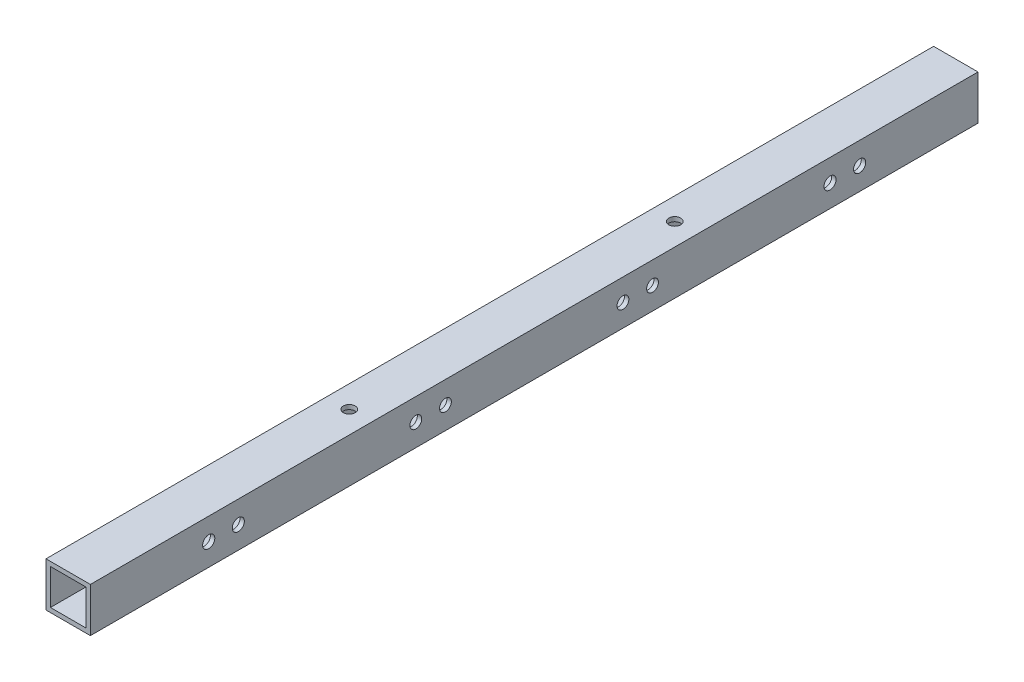
from build123d import *

# Parameters (mm, degrees)
SKETCH_1_W          = 15
SKETCH_1_H          = 15
SKETCH_1_W_2        = 12
SKETCH_1_H_2        = 12
EXTRUDE_1_DEPTH     = 300
SKETCH_2_R          = 2
CUT_EXTRUDE_1_DEPTH = 30
SKETCH_4_R          = 2.05
CUT_EXTRUDE_3_DEPTH = 120
SKETCH_5_R          = 2
CUT_EXTRUDE_4_DEPTH = 49


with BuildPart() as part:
    # 草图1 → 凸台-拉伸1 (new body)
    with BuildSketch(Plane.XY):
        Rectangle(SKETCH_1_W, SKETCH_1_H)
        Rectangle(SKETCH_1_W_2, SKETCH_1_H_2, mode=Mode.SUBTRACT)
    extrude(amount=EXTRUDE_1_DEPTH)

    # 草图2 → 切除-拉伸1 (cut)
    with BuildSketch(Plane(origin=(0, 7.5, 0), x_dir=(1, 0, 0), z_dir=(0, 1, 0))):
        with Locations(Location((0, -205, 0), (0, 0, 270))):
            Circle(SKETCH_2_R)
        with Locations(Location((0, -95, 0), (0, 0, 270))):
            Circle(SKETCH_2_R)
    extrude(amount=-CUT_EXTRUDE_1_DEPTH, mode=Mode.SUBTRACT)

    # 草图4 → 切除-拉伸3 (cut)
    with BuildSketch(Plane.ZY.offset(7.5)):
        with Locations((250, 0)):
            Circle(SKETCH_4_R)
        with Locations((260, 0)):
            Circle(SKETCH_4_R)
        with Locations(Location((40, 0, 0), (0, 0, 180))):
            Circle(SKETCH_4_R)
        with Locations(Location((50, 0, 0), (0, 0, 180))):
            Circle(SKETCH_4_R)
    extrude(amount=-CUT_EXTRUDE_3_DEPTH, mode=Mode.SUBTRACT)

    # 草图5 → 切除-拉伸4 (cut)
    with BuildSketch(Plane.ZY.offset(7.5)):
        with Locations((120, 0)):
            Circle(SKETCH_5_R)
        with Locations((110, 0)):
            Circle(SKETCH_5_R)
        with Locations(Location((190, 0, 0), (0, 0, 180))):
            Circle(SKETCH_5_R)
        with Locations(Location((180, 0, 0), (0, 0, 180))):
            Circle(SKETCH_5_R)
    extrude(amount=-CUT_EXTRUDE_4_DEPTH, mode=Mode.SUBTRACT)


solid = part.part
